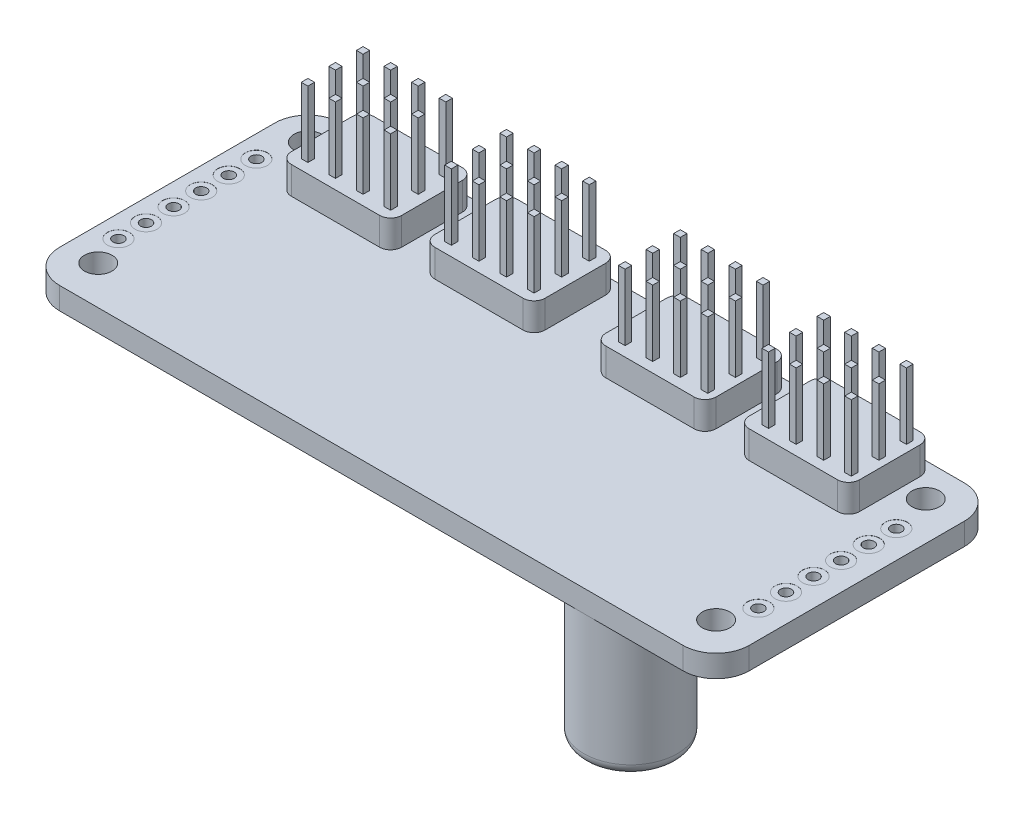
from build123d import *

# Parameters (mm, degrees)
SKETCH1_W           = 62.5
SKETCH1_H           = 25.5
BOSS_EXTRUDE1_DEPTH = 2
FILLET1_R           = 3
SKETCH2_W           = 10
SKETCH2_H           = 7.5
BOSS_EXTRUDE2_DEPTH = 2.5
FILLET2_R           = 1
SKETCH3_W           = 0.6
SKETCH3_H           = 0.6
BOSS_EXTRUDE3_DEPTH = 6
SKETCH4_R           = 1.25
CUT_EXTRUDE1_DEPTH  = 35.804812886
SKETCH5_R           = 4.25
BOSS_EXTRUDE4_DEPTH = 12
FILLET3_R           = 1
SKETCH6_R           = 0.5
CUT_EXTRUDE2_DEPTH  = 37.539362337
SKETCH7_R           = 1
CUT_EXTRUDE3_DEPTH  = 0.01


with BuildPart() as part:
    # Sketch1 → Boss-Extrude1 (new body)
    with BuildSketch(Plane(origin=(0, 0, 0), x_dir=(1, 0, 0), z_dir=(0, 1, 0))):
        Rectangle(SKETCH1_W, SKETCH1_H)
    extrude(amount=BOSS_EXTRUDE1_DEPTH)

    # Fillet1
    fillet1_edges = [part.edges().sort_by_distance(p)[0] for p in [
        (-31.25, 1, -12.75),
        (31.25, 1, -12.75),
        (31.25, 1, 12.75),
        (-31.25, 1, 12.75),
    ]]
    fillet(fillet1_edges, radius=FILLET1_R)

    # Sketch2 → Boss-Extrude2 (add)
    with BuildSketch(Plane(origin=(0, 2, 0), x_dir=(1, 0, 0), z_dir=(0, 1, 0))):
        with Locations((-20.75, 8.5)):
            Rectangle(SKETCH2_W, SKETCH2_H)
        with Locations((-7.75, 8.5)):
            Rectangle(SKETCH2_W, SKETCH2_H)
        with Locations((7.75, 8.5)):
            Rectangle(SKETCH2_W, SKETCH2_H)
        with Locations((20.75, 8.5)):
            Rectangle(SKETCH2_W, SKETCH2_H)
    extrude(amount=BOSS_EXTRUDE2_DEPTH)

    # Fillet2
    fillet2_edges = [part.edges().sort_by_distance(p)[0] for p in [
        (-25.75, 3.25, -12.25),
        (-25.75, 3.25, -4.75),
        (-15.75, 3.25, -4.75),
        (-15.75, 3.25, -12.25),
        (-12.75, 3.25, -12.25),
        (-12.75, 3.25, -4.75),
        (-2.75, 3.25, -4.75),
        (-2.75, 3.25, -12.25),
        (2.75, 3.25, -12.25),
        (2.75, 3.25, -4.75),
        (12.75, 3.25, -4.75),
        (12.75, 3.25, -12.25),
        (15.75, 3.25, -12.25),
        (15.75, 3.25, -4.75),
        (25.75, 3.25, -4.75),
        (25.75, 3.25, -12.25),
    ]]
    fillet(fillet2_edges, radius=FILLET2_R)

    # Sketch3 → Boss-Extrude3 (add)
    with BuildSketch(Plane(origin=(0, 4.5, 0), x_dir=(1, 0, 0), z_dir=(0, 1, 0))):
        with Locations((-24.45, 10.95)):
            Rectangle(SKETCH3_W, SKETCH3_H)
        with Locations((-21.95, 10.95)):
            Rectangle(SKETCH3_W, SKETCH3_H)
        with Locations((-19.45, 10.95)):
            Rectangle(SKETCH3_W, SKETCH3_H)
        with Locations((-16.95, 10.95)):
            Rectangle(SKETCH3_W, SKETCH3_H)
        with Locations((-21.95, 8.45)):
            Rectangle(SKETCH3_W, SKETCH3_H)
        with Locations((-19.45, 8.45)):
            Rectangle(SKETCH3_W, SKETCH3_H)
        with Locations((-16.95, 8.45)):
            Rectangle(SKETCH3_W, SKETCH3_H)
        with Locations((-21.95, 5.95)):
            Rectangle(SKETCH3_W, SKETCH3_H)
        with Locations((-19.45, 5.95)):
            Rectangle(SKETCH3_W, SKETCH3_H)
        with Locations((-16.95, 5.95)):
            Rectangle(SKETCH3_W, SKETCH3_H)
        with Locations((-24.45, 8.45)):
            Rectangle(SKETCH3_W, SKETCH3_H)
        with Locations((-24.45, 5.95)):
            Rectangle(SKETCH3_W, SKETCH3_H)
        with Locations((-11.45, 10.95)):
            Rectangle(SKETCH3_W, SKETCH3_H)
        with Locations((-8.95, 10.95)):
            Rectangle(SKETCH3_W, SKETCH3_H)
        with Locations((-6.45, 10.95)):
            Rectangle(SKETCH3_W, SKETCH3_H)
        with Locations((-3.95, 10.95)):
            Rectangle(SKETCH3_W, SKETCH3_H)
        with Locations((-8.95, 8.45)):
            Rectangle(SKETCH3_W, SKETCH3_H)
        with Locations((-6.45, 8.45)):
            Rectangle(SKETCH3_W, SKETCH3_H)
        with Locations((-3.95, 8.45)):
            Rectangle(SKETCH3_W, SKETCH3_H)
        with Locations((-8.95, 5.95)):
            Rectangle(SKETCH3_W, SKETCH3_H)
        with Locations((-6.45, 5.95)):
            Rectangle(SKETCH3_W, SKETCH3_H)
        with Locations((-3.95, 5.95)):
            Rectangle(SKETCH3_W, SKETCH3_H)
        with Locations((-11.45, 8.45)):
            Rectangle(SKETCH3_W, SKETCH3_H)
        with Locations((-11.45, 5.95)):
            Rectangle(SKETCH3_W, SKETCH3_H)
        with Locations((4.3, 10.95)):
            Rectangle(SKETCH3_W, SKETCH3_H)
        with Locations((6.8, 10.95)):
            Rectangle(SKETCH3_W, SKETCH3_H)
        with Locations((9.3, 10.95)):
            Rectangle(SKETCH3_W, SKETCH3_H)
        with Locations((11.8, 10.95)):
            Rectangle(SKETCH3_W, SKETCH3_H)
        with Locations((6.8, 8.45)):
            Rectangle(SKETCH3_W, SKETCH3_H)
        with Locations((9.3, 8.45)):
            Rectangle(SKETCH3_W, SKETCH3_H)
        with Locations((11.8, 8.45)):
            Rectangle(SKETCH3_W, SKETCH3_H)
        with Locations((6.8, 5.95)):
            Rectangle(SKETCH3_W, SKETCH3_H)
        with Locations((9.3, 5.95)):
            Rectangle(SKETCH3_W, SKETCH3_H)
        with Locations((11.8, 5.95)):
            Rectangle(SKETCH3_W, SKETCH3_H)
        with Locations((4.3, 8.45)):
            Rectangle(SKETCH3_W, SKETCH3_H)
        with Locations((4.3, 5.95)):
            Rectangle(SKETCH3_W, SKETCH3_H)
        with Locations((17.3, 10.95)):
            Rectangle(SKETCH3_W, SKETCH3_H)
        with Locations((19.8, 10.95)):
            Rectangle(SKETCH3_W, SKETCH3_H)
        with Locations((22.3, 10.95)):
            Rectangle(SKETCH3_W, SKETCH3_H)
        with Locations((24.8, 10.95)):
            Rectangle(SKETCH3_W, SKETCH3_H)
        with Locations((19.8, 8.45)):
            Rectangle(SKETCH3_W, SKETCH3_H)
        with Locations((22.3, 8.45)):
            Rectangle(SKETCH3_W, SKETCH3_H)
        with Locations((24.8, 8.45)):
            Rectangle(SKETCH3_W, SKETCH3_H)
        with Locations((19.8, 5.95)):
            Rectangle(SKETCH3_W, SKETCH3_H)
        with Locations((22.3, 5.95)):
            Rectangle(SKETCH3_W, SKETCH3_H)
        with Locations((24.8, 5.95)):
            Rectangle(SKETCH3_W, SKETCH3_H)
        with Locations((17.3, 8.45)):
            Rectangle(SKETCH3_W, SKETCH3_H)
        with Locations((17.3, 5.95)):
            Rectangle(SKETCH3_W, SKETCH3_H)
    extrude(amount=BOSS_EXTRUDE3_DEPTH)

    # Sketch4 → Cut-Extrude1 (cut, through all)
    with BuildSketch(Plane(origin=(0, 2, 0), x_dir=(1, 0, 0), z_dir=(0, 1, 0))):
        with Locations(Location((-28.25, 9.75, 0), (0, 0, 270))):
            Circle(SKETCH4_R)
        with Locations(Location((27.75, 9.75, 0), (0, 0, 270))):
            Circle(SKETCH4_R)
        with Locations(Location((27.75, -9.25, 0), (0, 0, 270))):
            Circle(SKETCH4_R)
        with Locations(Location((-28.25, -9.25, 0), (0, 0, 270))):
            Circle(SKETCH4_R)
    extrude(amount=-CUT_EXTRUDE1_DEPTH, mode=Mode.SUBTRACT)

    # Sketch5 → Boss-Extrude4 (add)
    with BuildSketch(Plane(origin=(0, 0, 0), x_dir=(1, 0, 0), z_dir=(0, 1, 0))):
        with Locations(Location((19.25, -8.5, 0), (0, 0, 270))):
            Circle(SKETCH5_R)
    extrude(amount=-BOSS_EXTRUDE4_DEPTH)

    # Fillet3
    fillet3_edges = [part.edges().sort_by_distance(p)[0] for p in [
        (19.25, -12, 4.25),
    ]]
    fillet(fillet3_edges, radius=FILLET3_R)

    # Sketch6 → Cut-Extrude2 (cut, through all)
    with BuildSketch(Plane(origin=(0, 2, 0), x_dir=(1, 0, 0), z_dir=(0, 1, 0))):
        with Locations(Location((-29.25, 6.08109928, 0), (0, 0, 270))):
            Circle(SKETCH6_R)
        with Locations(Location((-29.25, 3.58109928, 0), (0, 0, 270))):
            Circle(SKETCH6_R)
        with Locations(Location((-29.25, 1.08109928, 0), (0, 0, 270))):
            Circle(SKETCH6_R)
        with Locations(Location((-29.25, -1.41890072, 0), (0, 0, 270))):
            Circle(SKETCH6_R)
        with Locations(Location((-29.25, -3.91890072, 0), (0, 0, 270))):
            Circle(SKETCH6_R)
        with Locations(Location((-29.25, -6.41890072, 0), (0, 0, 270))):
            Circle(SKETCH6_R)
        with Locations(Location((28.75, 3.58109928, 0), (0, 0, 270))):
            Circle(SKETCH6_R)
        with Locations(Location((28.75, 6.08109928, 0), (0, 0, 270))):
            Circle(SKETCH6_R)
        with Locations(Location((28.75, 1.08109928, 0), (0, 0, 270))):
            Circle(SKETCH6_R)
        with Locations(Location((28.75, -1.41890072, 0), (0, 0, 270))):
            Circle(SKETCH6_R)
        with Locations(Location((28.75, -3.91890072, 0), (0, 0, 270))):
            Circle(SKETCH6_R)
        with Locations(Location((28.75, -6.41890072, 0), (0, 0, 270))):
            Circle(SKETCH6_R)
    extrude(amount=-CUT_EXTRUDE2_DEPTH, mode=Mode.SUBTRACT)

    # Sketch7 → Cut-Extrude3 (cut)
    with BuildSketch(Plane(origin=(0, 2, 0), x_dir=(1, 0, 0), z_dir=(0, 1, 0))):
        with Locations(Location((-29.25, 3.58109928, 0), (0, 0, 270))):
            Circle(SKETCH7_R)
        with Locations(Location((-29.25, 6.08109928, 0), (0, 0, 270))):
            Circle(SKETCH7_R)
        with Locations(Location((-29.25, 1.08109928, 0), (0, 0, 270))):
            Circle(SKETCH7_R)
        with Locations(Location((-29.25, -1.41890072, 0), (0, 0, 270))):
            Circle(SKETCH7_R)
        with Locations(Location((-29.25, -3.91890072, 0), (0, 0, 270))):
            Circle(SKETCH7_R)
        with Locations(Location((-29.25, -6.41890072, 0), (0, 0, 270))):
            Circle(SKETCH7_R)
        with Locations(Location((28.75, 6.08109928, 0), (0, 0, 270))):
            Circle(SKETCH7_R)
        with Locations(Location((28.75, 3.58109928, 0), (0, 0, 270))):
            Circle(SKETCH7_R)
        with Locations(Location((28.75, 1.08109928, 0), (0, 0, 270))):
            Circle(SKETCH7_R)
        with Locations(Location((28.75, -1.41890072, 0), (0, 0, 270))):
            Circle(SKETCH7_R)
        with Locations(Location((28.75, -3.91890072, 0), (0, 0, 270))):
            Circle(SKETCH7_R)
        with Locations(Location((28.75, -6.41890072, 0), (0, 0, 270))):
            Circle(SKETCH7_R)
    extrude(amount=-CUT_EXTRUDE3_DEPTH, mode=Mode.SUBTRACT)


solid = part.part
